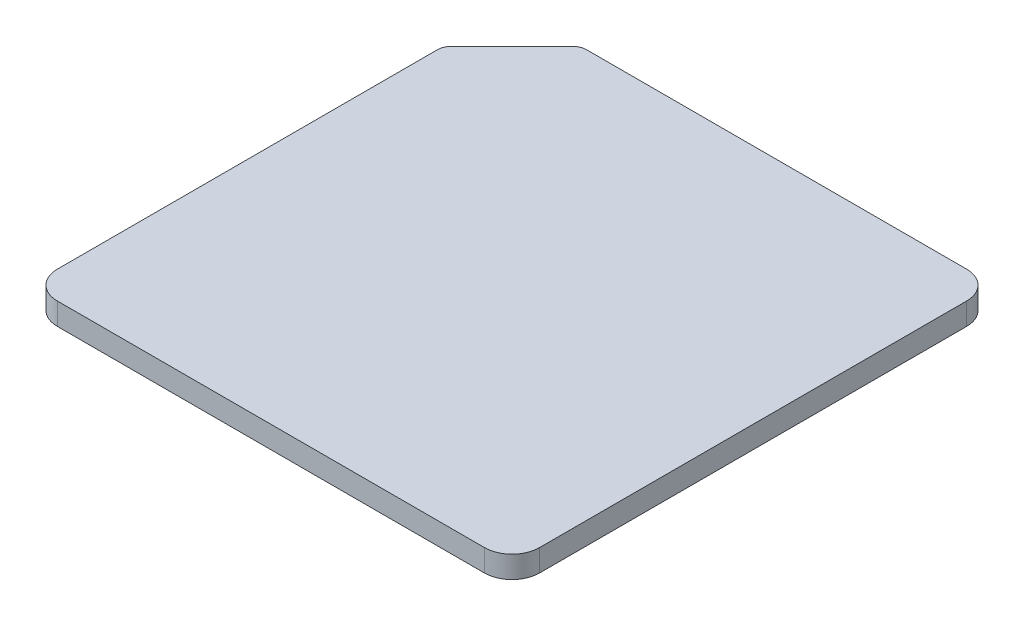
from build123d import *

# Parameters (mm, degrees)
SKETCH_1_W      = 35
SKETCH_1_H      = 35
EXTRUDE_1_DEPTH = 1.6
CHAMFER_1_SIZE  = 5
FILLET_1_R      = 1
FILLET_2_R      = 2


with BuildPart() as part:
    # 草图1 → 凸台-拉伸1 (new body)
    with BuildSketch(Plane(origin=(0, 0, 0), x_dir=(1, 0, 0), z_dir=(0, 1, 0))):
        Rectangle(SKETCH_1_W, SKETCH_1_H)
    extrude(amount=EXTRUDE_1_DEPTH)

    # 倒角1
    chamfer_1_edges = [part.edges().sort_by_distance(p)[0] for p in [
        (-17.5, 0.8, -17.5),
    ]]
    chamfer(chamfer_1_edges, length=CHAMFER_1_SIZE)

    # 圆角1
    fillet_1_edges = [part.edges().sort_by_distance(p)[0] for p in [
        (-17.5, 0.8, -12.5),
        (-12.5, 0.8, -17.5),
    ]]
    fillet(fillet_1_edges, radius=FILLET_1_R)

    # 圆角2
    fillet_2_edges = [part.edges().sort_by_distance(p)[0] for p in [
        (17.5, 0.8, 17.5),
        (-17.5, 0.8, 17.5),
        (17.5, 0.8, -17.5),
    ]]
    fillet(fillet_2_edges, radius=FILLET_2_R)


solid = part.part
